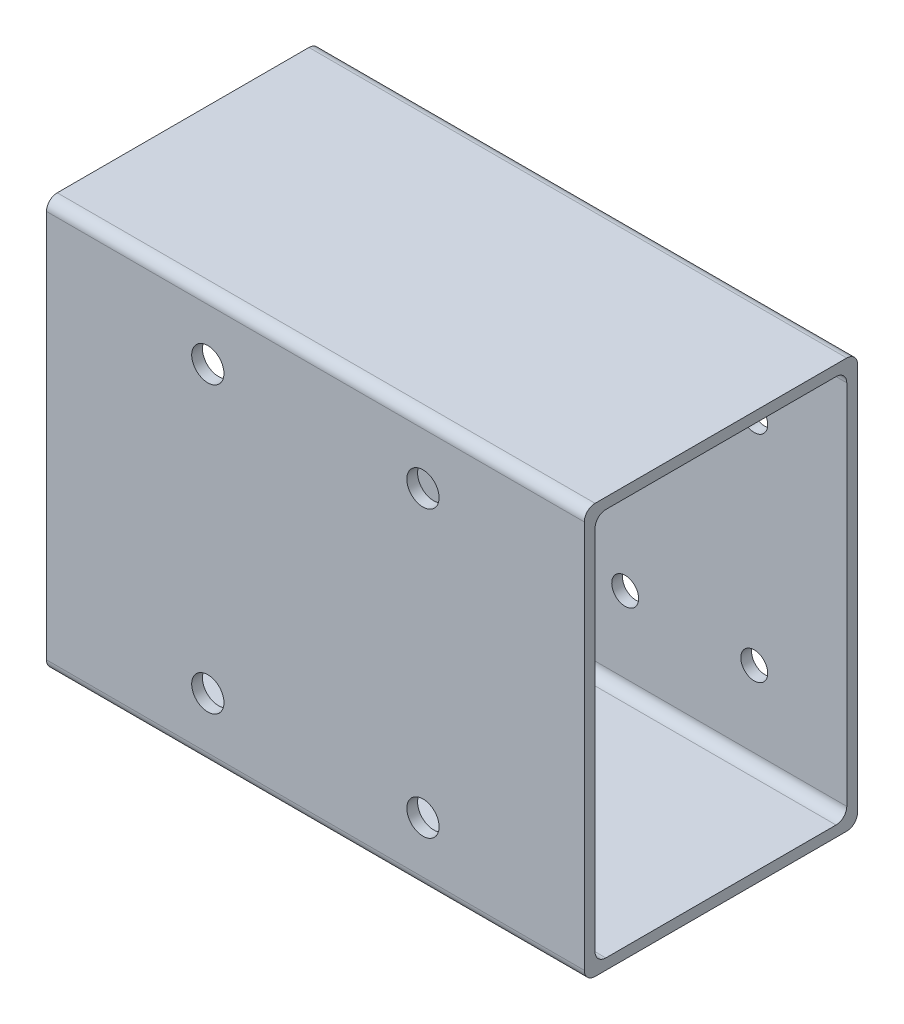
from build123d import *

# Parameters (mm, degrees)
SKETCH1_W             = 50.8
SKETCH1_H             = 76.2
BOSS_EXTRUDE1_DEPTH   = 100
SKETCH2_W             = 46.8
SKETCH2_H             = 72.2
CUT_EXTRUDE1_DEPTH    = 110.985317202
FILLET2_R             = 2
CORTAR_EXTRUIR2_DEPTH = 10
CROQUIS4_R            = 2.5
CORTAR_EXTRUIR5_DEPTH = 10
CROQUIS6_R            = 2.5
CORTAR_EXTRUIR6_DEPTH = 10


with BuildPart() as part:
    # Sketch1 → Boss-Extrude1 (new body)
    with BuildSketch(Plane(origin=(0, 0, 0), x_dir=(0, 0, -1), z_dir=(1, 0, 0))):
        Rectangle(SKETCH1_W, SKETCH1_H)
    extrude(amount=-BOSS_EXTRUDE1_DEPTH)

    # Sketch2 → Cut-Extrude1 (cut, through all)
    with BuildSketch(Plane(origin=(0, 0, 0), x_dir=(0, 0, -1), z_dir=(1, 0, 0))):
        Rectangle(SKETCH2_W, SKETCH2_H)
    extrude(amount=-CUT_EXTRUDE1_DEPTH, mode=Mode.SUBTRACT)

    # Fillet2
    fillet2_edges = [part.edges().sort_by_distance(p)[0] for p in [
        (-50, -36.1, 23.4),
        (-50, 36.1, 23.4),
        (-50, 36.1, -23.4),
        (-50, -36.1, -23.4),
        (-50, 38.1, 25.4),
        (-50, 38.1, -25.4),
        (-50, -38.1, -25.4),
        (-50, -38.1, 25.4),
    ]]
    fillet(fillet2_edges, radius=FILLET2_R)

    # Croquis2 → Cortar-Extruir2 (cut)
    with BuildSketch(Plane.XY.offset(25.4)):
        with BuildLine():
            ThreePointArc((-27, 26.5), (-30, 29.5), (-33, 26.5))
            Line((-33, 26.5), (-30, 26.5))
            Line((-30, 26.5), (-30, 23.5))
            ThreePointArc((-30, 23.5), (-27.878679656, 24.378679656), (-27, 26.5))
        make_face()
        with BuildLine():
            Line((-30, 26.5), (-33, 26.5))
            ThreePointArc((-33, 26.5), (-32.121320344, 24.378679656), (-30, 23.5))
            Line((-30, 23.5), (-30, 26.5))
        make_face()
        with BuildLine():
            ThreePointArc((-70, 23.5), (-67.878679656, 24.378679656), (-67, 26.5))
            Line((-67, 26.5), (-70, 26.5))
            Line((-70, 26.5), (-70, 23.5))
        make_face()
        with BuildLine():
            Line((-70, 26.5), (-67, 26.5))
            ThreePointArc((-67, 26.5), (-72.121320344, 28.621320344), (-70, 23.5))
            Line((-70, 23.5), (-70, 26.5))
        make_face()
        with BuildLine():
            ThreePointArc((-67, -26.5), (-67.878679656, -24.378679656), (-70, -23.5))
            Line((-70, -23.5), (-70, -26.5))
            Line((-70, -26.5), (-67, -26.5))
        make_face()
        with BuildLine():
            Line((-70, -26.5), (-70, -23.5))
            ThreePointArc((-70, -23.5), (-72.121320344, -28.621320344), (-67, -26.5))
            Line((-67, -26.5), (-70, -26.5))
        make_face()
        with BuildLine():
            ThreePointArc((-27, -26.5), (-27.878679656, -24.378679656), (-30, -23.5))
            Line((-30, -23.5), (-30, -26.5))
            Line((-30, -26.5), (-33, -26.5))
            ThreePointArc((-33, -26.5), (-30, -29.5), (-27, -26.5))
        make_face()
        with BuildLine():
            Line((-30, -26.5), (-30, -23.5))
            ThreePointArc((-30, -23.5), (-32.121320344, -24.378679656), (-33, -26.5))
            Line((-33, -26.5), (-30, -26.5))
        make_face()
    extrude(amount=-CORTAR_EXTRUIR2_DEPTH, mode=Mode.SUBTRACT)

    # Croquis4 → Cortar-Extruir5 (cut)
    with BuildSketch(Plane(origin=(0, 0, -25.4), x_dir=(-1, 0, 0), z_dir=(0, 0, -1))):
        with Locations(Location((90, 20, 0), (0, 0, 90))):
            Circle(CROQUIS4_R)
        with Locations(Location((59.2, 20, 0), (0, 0, 90))):
            Circle(CROQUIS4_R)
        with Locations(Location((59.2, -20, 0), (0, 0, 90))):
            Circle(CROQUIS4_R)
        with Locations(Location((90, -20, 0), (0, 0, 90))):
            Circle(CROQUIS4_R)
        with Locations(Location((74.6, 0, 0), (0, 0, 90))):
            Circle(CROQUIS4_R)
    extrude(amount=-CORTAR_EXTRUIR5_DEPTH, mode=Mode.SUBTRACT)

    # Croquis6 → Cortar-Extruir6 (cut)
    with BuildSketch(Plane(origin=(0, 0, -25.4), x_dir=(-1, 0, 0), z_dir=(0, 0, -1))):
        with Locations(Location((17.2, 20, 0), (0, 0, 90))):
            Circle(CROQUIS6_R)
        with Locations(Location((17.2, -20, 0), (0, 0, 90))):
            Circle(CROQUIS6_R)
        with Locations(Location((41.2, -20, 0), (0, 0, 90))):
            Circle(CROQUIS6_R)
        with Locations(Location((41.2, 20, 0), (0, 0, 90))):
            Circle(CROQUIS6_R)
    extrude(amount=-CORTAR_EXTRUIR6_DEPTH, mode=Mode.SUBTRACT)


solid = part.part
